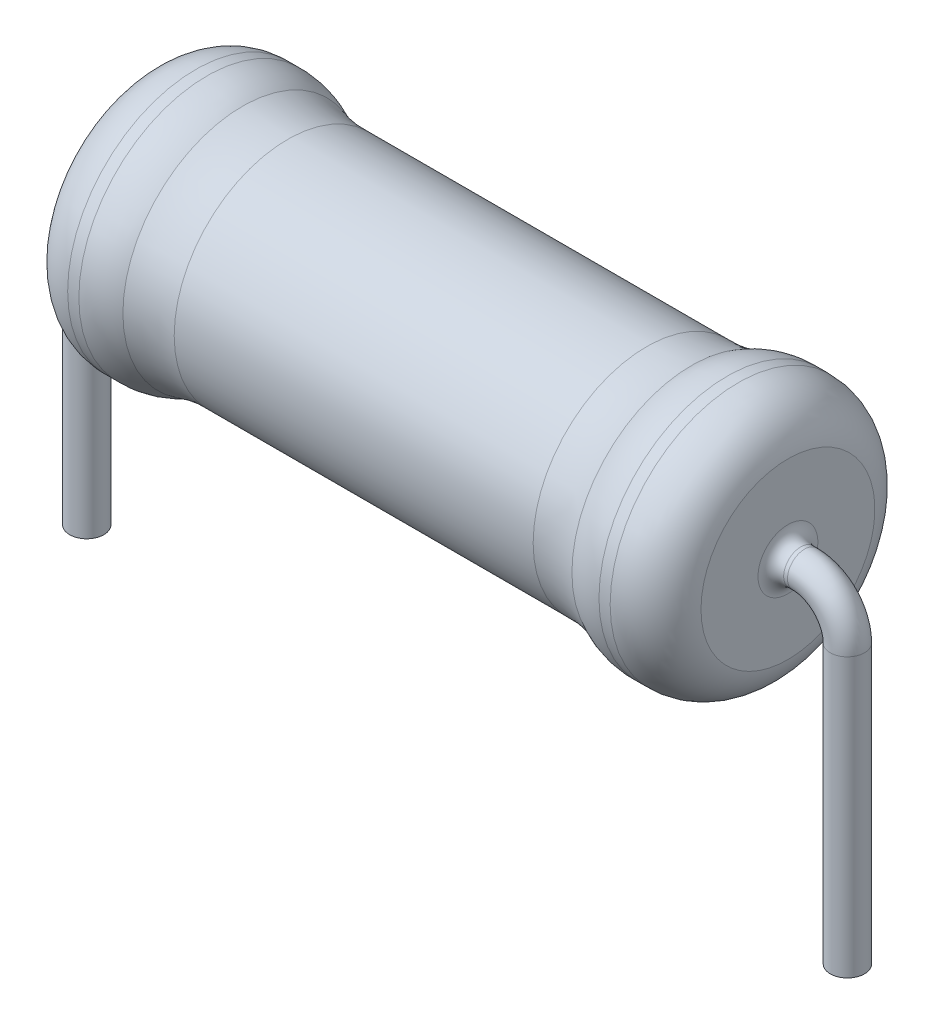
from build123d import *

# Parameters (mm, degrees)
SKETCH1_R           = 0.4
BOSS_EXTRUDE1_DEPTH = 5.3
SKETCH4_R           = 0.4
FILLET1_R           = 0.3


with BuildPart() as part:
    # Sketch1 → Boss-Extrude1 (new body)
    with BuildSketch(Plane(origin=(0, 0, 0), x_dir=(1, 0, 0), z_dir=(0, 1, 0))):
        with Locations(Location((8.89, 0, 0), (0, 0, 90))):
            Circle(SKETCH1_R)
    boss_extrude1 = extrude(amount=BOSS_EXTRUDE1_DEPTH)



with BuildPart() as body_2:
    # Sketch2 → Revolve1 (revolve)
    with BuildSketch(Plane.XY, mode=Mode.PRIVATE) as revolve1_sk:
        with BuildLine():
            Line((-7.5, 7.5), (7.5, 7.5))
            Line((7.5, 7.5), (7.5, 9.532279676))
            ThreePointArc((7.5, 9.532279676), (7.093393803, 10.222552101), (6.340357644, 10.495940404))
            Line((6.340357644, 10.495940404), (6.078780295, 10.495940404))
            ThreePointArc((6.078780295, 10.495940404), (5.649377435, 10.454699102), (5.247776116, 10.297206111))
            ThreePointArc((5.247776116, 10.297206111), (4.728245215, 10.175688355), (4.19527223, 10.150814298))
            Line((4.19527223, 10.150814298), (-4.19527223, 10.150814298))
            ThreePointArc((-4.19527223, 10.150814298), (-4.728245215, 10.175688355), (-5.247776116, 10.297206111))
            ThreePointArc((-5.247776116, 10.297206111), (-5.649377435, 10.454699102), (-6.078780295, 10.495940404))
            Line((-6.078780295, 10.495940404), (-6.340357644, 10.495940404))
            ThreePointArc((-6.340357644, 10.495940404), (-7.093393803, 10.222552101), (-7.5, 9.532279676))
            Line((-7.5, 9.532279676), (-7.5, 7.5))
        make_face()
    revolve(revolve1_sk.sketch.rotate(Axis((-7.5, 7.5, 0), (1, 0, 0)), 90), axis=Axis((-7.5, 7.5, 0), (1, 0, 0)))


with BuildPart() as part_1:
    add(part.part)

    add(body_2.part)  # Sweep1 merges body 2
    # Sweep1: sweep along a path in Sketch3
    with BuildLine(Plane.XY) as sweep1_path:
        Line((3.5, 7.5), (7.89, 7.5))
        ThreePointArc((7.89, 7.5), (8.597106781, 7.207106781), (8.89, 6.5))
        Line((8.89, 6.5), (8.89, 5.3))
    # Sketch4 → Sweep1 (sweep)
    with BuildSketch(Plane(origin=(0, 5.3, 0), x_dir=(1, 0, 0), z_dir=(0, 1, 0))):
        with Locations((8.89, 0)):
            Circle(SKETCH4_R)
    sweep1 = sweep(path=sweep1_path.line)

    # Mirror1: Boss-Extrude1, Sweep1 across plane
    add(boss_extrude1.mirror(Plane(origin=(0, 0, 0), x_dir=(0, 0, 1), z_dir=(1, 0, 0))))
    add(sweep1.mirror(Plane(origin=(0, 0, 0), x_dir=(0, 0, 1), z_dir=(1, 0, 0))))

    # Fillet1
    fillet1_edges = [part_1.edges().sort_by_distance(p)[0] for p in [
        (7.5, 7.1, 0),
        (-7.5, 7.1, 0),
    ]]
    fillet(fillet1_edges, radius=FILLET1_R)


solid = part_1.part
